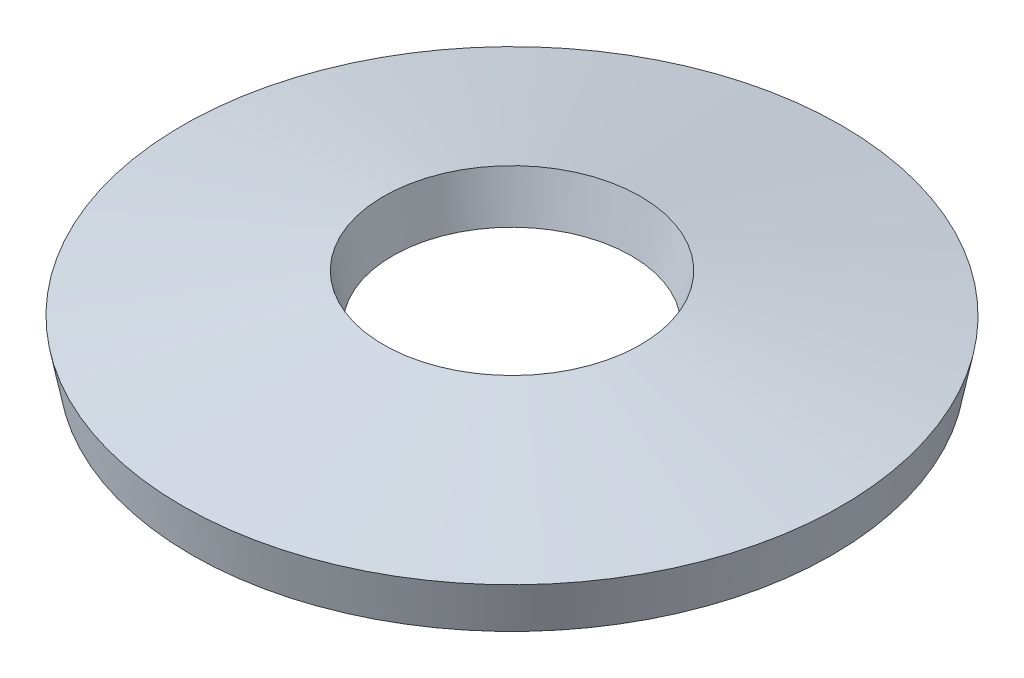
from build123d import *


with BuildPart() as part:
    # Sketch1 → Revolve1 (revolve)
    with BuildSketch(Plane.XY, mode=Mode.PRIVATE) as revolve1_sk:
        Polygon((8.520613483, 0), (3.175, 1.039344965), (3.417386517, 2.286), (8.763, 1.246655035), align=None)
    revolve(revolve1_sk.sketch.rotate(Axis((0, 0, 0), (0, 1, 0)), 90), axis=Axis((0, 0, 0), (0, 1, 0)))


solid = part.part
